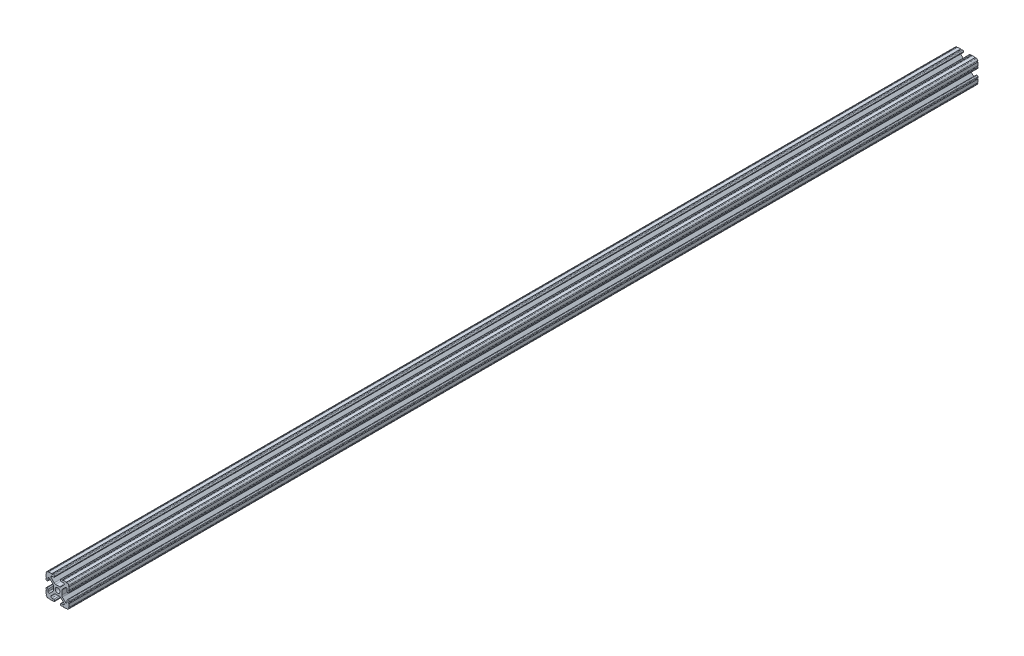
from build123d import *

# Parameters (mm, degrees)
BOSS_EXTRUDE1_DEPTH     = 500
CUT_EXTRUDE1_DEPTH      = 501.322476009
CUT_EXTRUDE1_DEPTH_BACK = 501.322476009
SKETCH5_R               = 0.55245


with BuildPart() as part:
    # Sketch4 → Boss-Extrude1 (new, symmetric)
    with BuildSketch(Plane.XY):
        with BuildLine():
            Line((4.190365, -12.7), (10.11729625, -12.7))
            ThreePointArc((10.11729625, -12.7), (11.943543585, -11.943543585), (12.7, -10.11729625))
            Line((12.7, -10.11729625), (12.7, -4.190365))
            ThreePointArc((12.7, -4.190365), (12.42492494, -3.52627506), (11.760835, -3.2512))
            Line((11.760835, -3.2512), (11.429365, -3.2512))
            ThreePointArc((11.429365, -3.2512), (10.76527506, -3.52627506), (10.4902, -4.190365))
            Line((10.4902, -4.190365), (10.4902, -6.348478019))
            ThreePointArc((10.4902, -6.348478019), (9.830707141, -7.335478831), (8.666460301, -7.103895736))
            Line((8.666460301, -7.103895736), (5.299899128, -3.737334563))
            ThreePointArc((5.299899128, -3.737334563), (4.817571085, -3.015479634), (4.6482, -2.16399369))
            Line((4.6482, -2.16399369), (4.6482, 0))
            Line((4.6482, 0), (2.6035, 0))
            ThreePointArc((2.6035, 0), (1.840952505, -1.840952505), (0, -2.6035))
            Line((0, -2.6035), (0, -4.6482))
            Line((0, -4.6482), (2.16399369, -4.6482))
            ThreePointArc((2.16399369, -4.6482), (3.015479634, -4.817571085), (3.737334563, -5.299899128))
            Line((3.737334563, -5.299899128), (7.103895736, -8.666460301))
            ThreePointArc((7.103895736, -8.666460301), (7.335478831, -9.830707141), (6.348478019, -10.4902))
            Line((6.348478019, -10.4902), (4.190365, -10.4902))
            ThreePointArc((4.190365, -10.4902), (3.52627506, -10.76527506), (3.2512, -11.429365))
            Line((3.2512, -11.429365), (3.2512, -11.760835))
            ThreePointArc((3.2512, -11.760835), (3.52627506, -12.42492494), (4.190365, -12.7))
        make_face()
    extrude(amount=BOSS_EXTRUDE1_DEPTH, both=True)

    # Sketch5 → Cut-Extrude1 (cut, two sides: drawn at the far end of the back side and taken through both)
    with BuildSketch(Plane.XY.offset(-CUT_EXTRUDE1_DEPTH_BACK)):
        with Locations((10.356153152, -12.7)):
            Circle(SKETCH5_R)
        with Locations((5.796028019, -12.7)):
            Circle(SKETCH5_R)
        with Locations((12.7, -10.356153152)):
            Circle(SKETCH5_R)
        with Locations((12.7, -5.796028019)):
            Circle(SKETCH5_R)
    extrude(amount=CUT_EXTRUDE1_DEPTH + CUT_EXTRUDE1_DEPTH_BACK, mode=Mode.SUBTRACT)

    # Mirror1: part across plane


with BuildPart() as part_1:
    add(part.part)
    add(part.part.mirror(Plane(origin=(0, 0, 0), x_dir=(0, 0, 1), z_dir=(1, 0, 0))))

    # Mirror2: part across plane


with BuildPart() as part_2:
    add(part_1.part)
    add(part_1.part.mirror(Plane.ZX))


solid = part_2.part
